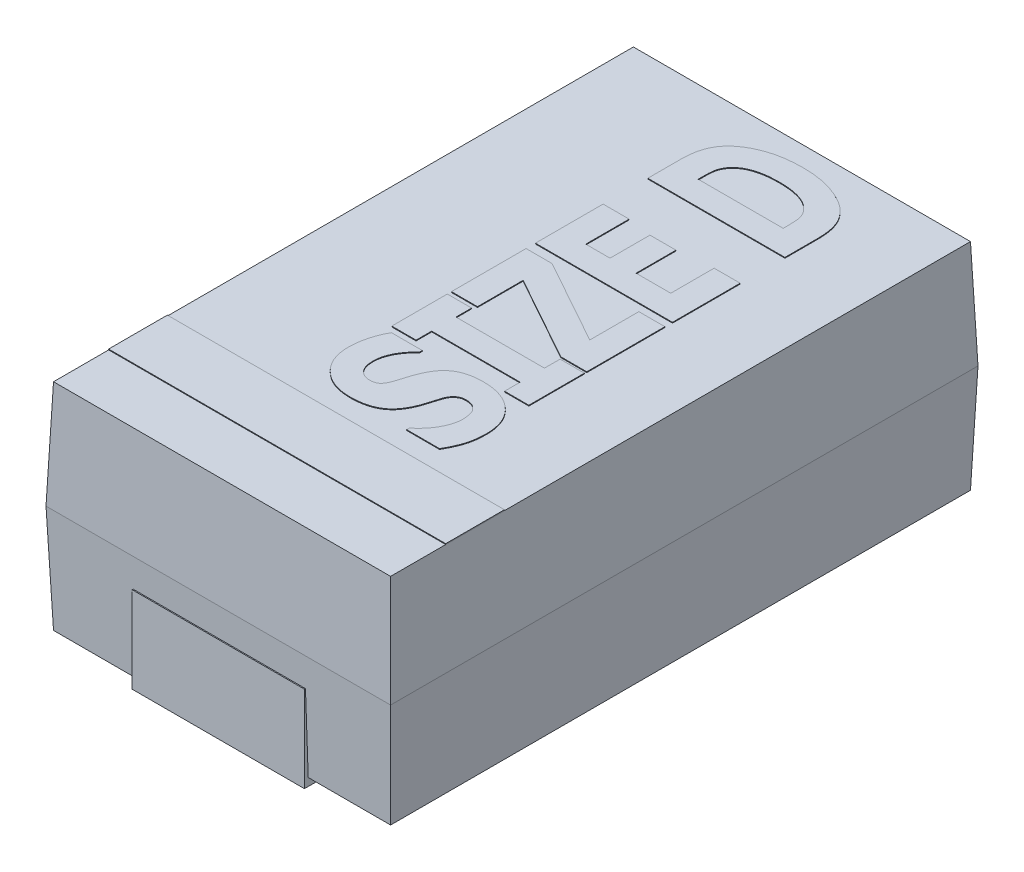
from build123d import *

# Parameters (mm, degrees)
SKETCH1_W                     = 4.4
SKETCH1_H                     = 7.5
BOSS_EXTRUDE1_DEPTH           = 1.375
BOSS_EXTRUDE1_TAPER           = 2
BOSS_EXTRUDE1_OTHER_WAY_DEPTH = 1.375
BOSS_EXTRUDE1_OTHER_WAY_TAPER = 2
BOSS_EXTRUDE2_DEPTH           = 0.1
BOSS_EXTRUDE2_DEPTH_BACK      = 1
SKETCH2_W                     = 2.2
SKETCH2_H                     = 1.35
SKETCH3_W                     = 4.303967884
SKETCH3_H                     = 0.75
EXTRUDE_THIN1_DEPTH           = 0.01
BOSS_EXTRUDE3_DEPTH           = 0.01


with BuildPart() as part:
    # Sketch1 → Boss-Extrude1 (new body)
    with BuildSketch(Plane(origin=(0, 0, 0), x_dir=(1, 0, 0), z_dir=(0, 1, 0))):
        Rectangle(SKETCH1_W, SKETCH1_H)
    extrude(amount=BOSS_EXTRUDE1_DEPTH, taper=BOSS_EXTRUDE1_TAPER)

    # Sketch1 → Boss-Extrude1 other way (add)
    with BuildSketch(Plane(origin=(0, 0, 0), x_dir=(1, 0, 0), z_dir=(0, 1, 0))):
        Rectangle(SKETCH1_W, SKETCH1_H)
    extrude(amount=-BOSS_EXTRUDE1_OTHER_WAY_DEPTH, taper=BOSS_EXTRUDE1_OTHER_WAY_TAPER)

    # Sketch2 → Boss-Extrude2 (add, two sides: drawn at the far end of the back side and taken through both)
    with BuildSketch(Plane.XZ.offset(1.375).offset(-BOSS_EXTRUDE2_DEPTH_BACK)):
        with Locations((0, 3.075)):
            Rectangle(SKETCH2_W, SKETCH2_H)
        with Locations((0, -3.075)):
            Rectangle(SKETCH2_W, SKETCH2_H)
    extrude(amount=BOSS_EXTRUDE2_DEPTH + BOSS_EXTRUDE2_DEPTH_BACK)

    # Sketch3 → Extrude-Thin1 (add)
    with BuildSketch(Plane(origin=(0, 1.375, 0), x_dir=(1, 0, 0), z_dir=(0, 1, 0))):
        with Locations((0, -2.623518775)):
            Rectangle(SKETCH3_W, SKETCH3_H)
    extrude(amount=EXTRUDE_THIN1_DEPTH)

    # Sketch4 → Boss-Extrude3 (add)
    # profile 1 of 5: a face of its own
    with BuildSketch(Plane(origin=(0, 1.375, 0), x_dir=(1, 0, 0), z_dir=(0, 1, 0))):
        with BuildLine():
            add(Edge.make_bspline(
                [(0.606493436, -0.96788767), (0.627855348, -0.968366119), (0.669656113, -0.969302344), (0.730823984, -0.976239091), (0.788809907, -0.988057313), (0.843852466, -1.004172825), (0.895652151, -1.025576177), (0.944728289, -1.050971871), (0.990251937, -1.081914297), (1.032841449, -1.116597553), (1.071146809, -1.155599613), (1.104705699, -1.19819034), (1.133156378, -1.244036569), (1.15664734, -1.293166777), (1.174161804, -1.345921935), (1.186860597, -1.40190815), (1.195161094, -1.46121267), (1.195906837, -1.501927579), (1.196287739, -1.522723508)],
                knots=[0, 0, 0, 0, 1.123231077, 2.197926755, 3.231931198, 4.23205902, 5.208893471, 6.175023653, 7.132504262, 8.098119942, 9.059150163, 10.001029427, 10.943846196, 11.890986852, 12.857973929, 13.860252586, 14.907082517, 16, 16, 16, 16], degree=3))
            add(Edge.make_bspline(
                [(1.196287739, -1.522723508), (1.195812717, -1.546621277), (1.194892682, -1.59290706), (1.188098086, -1.66010049), (1.176011938, -1.72250347), (1.159252817, -1.780556867), (1.138237159, -1.834866482), (1.115427196, -1.887379779), (1.090014195, -1.93818957), (1.070832731, -1.970711646), (1.061299607, -1.986875011)],
                knots=[0, 0, 0, 0, 1.170088317, 2.26625562, 3.302187664, 4.278401643, 5.220628038, 6.151609465, 7.08135594, 8, 8, 8, 8], degree=3))
            Line((1.061299607, -1.986875011), (0.642490271, -1.986875011))
            Line((0.642490271, -1.986875011), (0.642490271, -1.952954916))
            add(Edge.make_bspline(
                [(0.642490271, -1.952954916), (0.661306582, -1.936832417), (0.698242914, -1.905184025), (0.746577893, -1.852166473), (0.788713744, -1.796837434), (0.823297568, -1.738991535), (0.85115917, -1.680502263), (0.870930943, -1.62230799), (0.884008057, -1.565301286), (0.885454206, -1.527404462), (0.886161157, -1.508878571)],
                knots=[0, 0, 0, 0, 1.137748405, 2.233394795, 3.289549256, 4.328854387, 5.325001514, 6.260582723, 7.149684573, 8, 8, 8, 8], degree=3))
            add(Edge.make_bspline(
                [(0.886161157, -1.508878571), (0.885639877, -1.497902066), (0.884460308, -1.47306407), (0.879517882, -1.44112613), (0.874156377, -1.413350639), (0.868220554, -1.393493956), (0.861569254, -1.375368903), (0.855285345, -1.364813173), (0.852241062, -1.359699378)],
                knots=[0, 0, 0, 0, 1.279356194, 2.894969178, 3.759536177, 4.571858236, 5.308127055, 6, 6, 6, 6], degree=3))
            add(Edge.make_bspline(
                [(0.852241062, -1.359699378), (0.84380226, -1.348455921), (0.827011983, -1.326085357), (0.799096884, -1.303778096), (0.772745683, -1.290084886), (0.748320381, -1.283086154), (0.719844643, -1.278574343), (0.699390478, -1.278208564), (0.688524686, -1.278014252)],
                knots=[0, 0, 0, 0, 1.313748587, 2.613902296, 3.305346579, 4.085142053, 4.982776842, 6, 6, 6, 6], degree=3))
            add(Edge.make_bspline(
                [(0.688524686, -1.278014252), (0.67902821, -1.278384518), (0.6606231, -1.279102131), (0.633972213, -1.285535977), (0.609543518, -1.296418994), (0.587051708, -1.311416226), (0.567415613, -1.330910422), (0.549241212, -1.35357463), (0.534681421, -1.38091201), (0.526805826, -1.400692609), (0.522731569, -1.410925644)],
                knots=[0, 0, 0, 0, 0.997552441, 1.93335531, 2.862211005, 3.797699212, 4.758724122, 5.761134443, 6.841774632, 8, 8, 8, 8], degree=3))
            add(Edge.make_bspline(
                [(0.522731569, -1.410925644), (0.514942542, -1.434410807), (0.499014678, -1.48243587), (0.478266157, -1.555922054), (0.456415988, -1.629608591), (0.435455688, -1.676023381), (0.425124765, -1.698900328)],
                knots=[0, 0, 0, 0, 0.975309188, 1.994420259, 3.011488788, 4, 4, 4, 4], degree=3))
            add(Edge.make_bspline(
                [(0.425124765, -1.698900328), (0.4189248, -1.711320469), (0.406785652, -1.735638338), (0.38641346, -1.770227869), (0.3636281, -1.801499889), (0.340296623, -1.831048354), (0.314527002, -1.857183308), (0.287489455, -1.881004049), (0.258512235, -1.901779232), (0.228141601, -1.920222868), (0.195761113, -1.935761925), (0.161912597, -1.949806496), (0.125821165, -1.96105705), (0.087982377, -1.970287818), (0.048420955, -1.978141996), (0.006878108, -1.983079526), (-0.036551629, -1.986326192), (-0.066133413, -1.986689375), (-0.081253795, -1.986875011)],
                knots=[0, 0, 0, 0, 1.073445682, 2.101740216, 3.099543666, 4.063832661, 5.010289146, 5.933583054, 6.847386585, 7.763973722, 8.677777253, 9.622212832, 10.59574541, 11.597689141, 12.633619916, 13.712650431, 14.830848108, 16, 16, 16, 16], degree=3))
            add(Edge.make_bspline(
                [(-0.081253795, -1.986875011), (-0.101463672, -1.986396346), (-0.141081839, -1.985458002), (-0.199021417, -1.978500273), (-0.254095156, -1.966786321), (-0.306204719, -1.95004361), (-0.355701785, -1.928946911), (-0.402331714, -1.902818394), (-0.446026038, -1.87191743), (-0.486466844, -1.836627635), (-0.523025325, -1.797696675), (-0.555059936, -1.755778085), (-0.581821016, -1.71095973), (-0.604281043, -1.663803385), (-0.621042576, -1.61350466), (-0.633644848, -1.56085209), (-0.640976591, -1.505393043), (-0.641865977, -1.467595926), (-0.642319856, -1.448306973)],
                knots=[0, 0, 0, 0, 1.110899699, 2.17773761, 3.202861202, 4.201826735, 5.182111527, 6.156137979, 7.134615264, 8.119159157, 9.101903375, 10.066048987, 11.013525875, 11.96690795, 12.931720993, 13.922517702, 14.939801223, 16, 16, 16, 16], degree=3))
            add(Edge.make_bspline(
                [(-0.642319856, -1.448306973), (-0.641924026, -1.428560954), (-0.641130425, -1.388972032), (-0.634579, -1.32990217), (-0.624645268, -1.271133063), (-0.610547319, -1.213438662), (-0.592818142, -1.15805368), (-0.573677492, -1.105522567), (-0.55200397, -1.057064039), (-0.535447246, -1.026859538), (-0.527406881, -1.012191467)],
                knots=[0, 0, 0, 0, 1.039519936, 2.084140277, 3.125876998, 4.176486779, 5.208308838, 6.186738043, 7.119434044, 8, 8, 8, 8], degree=3))
            Line((-0.527406881, -1.012191467), (-0.132826185, -1.012191467))
            Line((-0.132826185, -1.012191467), (-0.132826185, -1.045765439))
            add(Edge.make_bspline(
                [(-0.132826185, -1.045765439), (-0.146735335, -1.058515278), (-0.174652549, -1.084105626), (-0.211453744, -1.128027838), (-0.245746998, -1.175216426), (-0.275787408, -1.226131698), (-0.300839425, -1.279417314), (-0.318996531, -1.334084824), (-0.330264884, -1.389579142), (-0.331551383, -1.426911349), (-0.332193273, -1.445537986)],
                knots=[0, 0, 0, 0, 0.984070871, 1.97513988, 2.984813114, 4.027106165, 5.056510584, 6.052673032, 7.028395148, 8, 8, 8, 8], degree=3))
            add(Edge.make_bspline(
                [(-0.332193273, -1.445537986), (-0.331762123, -1.458596281), (-0.330895, -1.484858902), (-0.324790459, -1.524202378), (-0.31269949, -1.563242602), (-0.298769447, -1.586872965), (-0.291696833, -1.59887066)],
                knots=[0, 0, 0, 0, 0.97418877, 1.959271968, 2.963873987, 4, 4, 4, 4], degree=3))
            add(Edge.make_bspline(
                [(-0.291696833, -1.59887066), (-0.288123307, -1.604038373), (-0.280785181, -1.614650112), (-0.267229252, -1.629158623), (-0.25099397, -1.642427518), (-0.232508811, -1.654421249), (-0.21202133, -1.664494837), (-0.189682555, -1.671312335), (-0.166257445, -1.676092255), (-0.150041859, -1.676527759), (-0.141825393, -1.676748429)],
                knots=[0, 0, 0, 0, 0.855403996, 1.756545736, 2.694648507, 3.706409739, 4.754179369, 5.793420774, 6.88192253, 8, 8, 8, 8], degree=3))
            add(Edge.make_bspline(
                [(-0.141825393, -1.676748429), (-0.130705959, -1.676326743), (-0.109723866, -1.675531032), (-0.080259335, -1.668468074), (-0.054794242, -1.657095419), (-0.032643935, -1.640233705), (-0.014016146, -1.616256694), (0.003488975, -1.585291171), (0.020369688, -1.546292654), (0.029672885, -1.517055088), (0.03469755, -1.501263856)],
                knots=[0, 0, 0, 0, 0.977411615, 1.844351051, 2.648603566, 3.416320099, 4.267959932, 5.300768973, 6.542143255, 8, 8, 8, 8], degree=3))
            add(Edge.make_bspline(
                [(0.03469755, -1.501263856), (0.04128472, -1.479461064), (0.054225895, -1.436627228), (0.073532455, -1.372047659), (0.096505344, -1.306335422), (0.116139865, -1.262984699), (0.126420255, -1.240286799)],
                knots=[0, 0, 0, 0, 0.986893501, 1.938854128, 2.920809672, 4, 4, 4, 4], degree=3))
            add(Edge.make_bspline(
                [(0.126420255, -1.240286799), (0.132023518, -1.229005225), (0.143086342, -1.2067314), (0.162326045, -1.175323236), (0.182503091, -1.145863043), (0.204565395, -1.118944424), (0.228148744, -1.094397351), (0.253026562, -1.071823571), (0.279462438, -1.051549825), (0.307721191, -1.033914224), (0.337725567, -1.018101744), (0.369887285, -1.004801211), (0.404083788, -0.993227261), (0.440437059, -0.983998536), (0.47893435, -0.976744745), (0.519618202, -0.971604006), (0.562370443, -0.968461386), (0.591604666, -0.968081263), (0.606493436, -0.96788767)],
                knots=[0, 0, 0, 0, 1.027654046, 2.028953039, 3.003320805, 3.940198746, 4.865983912, 5.77942601, 6.679715928, 7.581088694, 8.495113097, 9.444776638, 10.41855265, 11.439497146, 12.50331839, 13.614116899, 14.784887726, 16, 16, 16, 16], degree=3))
        make_face()
    # profile 2 of 5: a face of its own
    with BuildSketch(Plane(origin=(0, 1.375, 0), x_dir=(1, 0, 0), z_dir=(0, 1, 0))):
        Polygon((1.151983942, -0.228014252), (1.151983942, -0.936875011), (0.84185736, -0.936875011), (0.84185736, -0.737507923), (-0.287889476, -0.737507923), (-0.287889476, -0.936875011), (-0.598016058, -0.936875011), (-0.598016058, -0.228014252), (-0.287889476, -0.228014252), (-0.287889476, -0.42738134), (0.84185736, -0.42738134), (0.84185736, -0.228014252), align=None)
    # profile 3 of 5: a face of its own
    with BuildSketch(Plane(origin=(0, 1.375, 0), x_dir=(1, 0, 0), z_dir=(0, 1, 0))):
        Polygon((1.151983942, 0.799833849), (1.151983942, -0.197001594), (0.819705461, -0.197001594), (-0.265737577, 0.407676017), (-0.265737577, -0.174849695), (-0.598016058, -0.174849695), (-0.598016058, 0.777681951), (-0.265737577, 0.777681951), (0.819705461, 0.173350463), (0.819705461, 0.799833849), align=None)
    # profile 4 of 5: a face of its own
    with BuildSketch(Plane(origin=(0, 1.375, 0), x_dir=(1, 0, 0), z_dir=(0, 1, 0))):
        Polygon((1.151983942, 1.761226254), (1.151983942, 0.897302204), (-0.598016058, 0.897302204), (-0.598016058, 1.761226254), (-0.265737577, 1.761226254), (-0.265737577, 1.207428786), (0.044389005, 1.207428786), (0.044389005, 1.716922457), (0.376667486, 1.716922457), (0.376667486, 1.207428786), (0.819705461, 1.207428786), (0.819705461, 1.761226254), align=None)
    # profile 5 of 5: a face of its own
    with BuildSketch(Plane(origin=(0, 1.375, 0), x_dir=(1, 0, 0), z_dir=(0, 1, 0))):
        with BuildLine():
            add(Edge.make_bspline(
                [(0.278714559, 3.440340179), (0.298794878, 3.440170187), (0.338524892, 3.439833849), (0.397304738, 3.4362705), (0.454484369, 3.430489157), (0.509992314, 3.42202893), (0.563988386, 3.411834119), (0.616416704, 3.398930001), (0.667290022, 3.383807561), (0.71628734, 3.366082011), (0.763030132, 3.346846868), (0.807303361, 3.326361794), (0.848651235, 3.304640859), (0.887471139, 3.281867112), (0.922855708, 3.257117121), (0.956041826, 3.232042823), (0.986033958, 3.205192139), (1.004197558, 3.186062976), (1.013188451, 3.176594134)],
                knots=[0, 0, 0, 0, 1.202299543, 2.37881569, 3.524792316, 4.642557387, 5.740069071, 6.814150526, 7.874253958, 8.91664992, 9.932775139, 10.900245547, 11.836602954, 12.728793994, 13.593077179, 14.420800829, 15.218304153, 16, 16, 16, 16], degree=3))
            add(Edge.make_bspline(
                [(1.013188451, 3.176594134), (1.025559597, 3.162223716), (1.049867265, 3.13398774), (1.079513109, 3.087282503), (1.104244631, 3.039152279), (1.12212429, 2.987989494), (1.1357126, 2.93386727), (1.145348403, 2.87553114), (1.150699572, 2.812342069), (1.151545847, 2.768640029), (1.151983942, 2.746016603)],
                knots=[0, 0, 0, 0, 0.979866063, 1.925307591, 2.854324583, 3.773857627, 4.722159233, 5.738844466, 6.829457763, 8, 8, 8, 8], degree=3))
            Line((1.151983942, 2.746016603), (1.151983942, 2.332745242))
            Line((1.151983942, 2.332745242), (-0.598016058, 2.332745242))
            Line((-0.598016058, 2.332745242), (-0.598016058, 2.757784799))
            add(Edge.make_bspline(
                [(-0.598016058, 2.757784799), (-0.597714195, 2.780880957), (-0.597130109, 2.825570643), (-0.589928508, 2.889995153), (-0.579176806, 2.949596747), (-0.56350389, 3.004269243), (-0.543745508, 3.054635417), (-0.519739401, 3.100444937), (-0.492958399, 3.142879104), (-0.471325002, 3.167505962), (-0.460605061, 3.179709245)],
                knots=[0, 0, 0, 0, 1.219258587, 2.359192532, 3.419277855, 4.414487454, 5.358201337, 6.271217898, 7.143341151, 8, 8, 8, 8], degree=3))
            add(Edge.make_bspline(
                [(-0.460605061, 3.179709245), (-0.451153415, 3.189640759), (-0.43206871, 3.209694409), (-0.400808689, 3.237801944), (-0.366859109, 3.263918804), (-0.330766972, 3.288672403), (-0.292140307, 3.311429565), (-0.251337731, 3.332996175), (-0.20788823, 3.352589214), (-0.162377643, 3.371010692), (-0.114421609, 3.387297167), (-0.064362893, 3.401355575), (-0.012173141, 3.413546644), (0.041986316, 3.42353442), (0.098234643, 3.431208603), (0.156585537, 3.436105853), (0.216940266, 3.439886729), (0.257940825, 3.440187691), (0.278714559, 3.440340179)],
                knots=[0, 0, 0, 0, 0.815982718, 1.647627183, 2.499420194, 3.36432123, 4.251303357, 5.166838833, 6.110438719, 7.087419556, 8.088723728, 9.123690057, 10.18162513, 11.278206396, 12.401101364, 13.559583676, 14.763515377, 16, 16, 16, 16], degree=3))
        make_face()
        with BuildLine():
            add(Edge.make_bspline(
                [(0.275945572, 3.130213596), (0.248354495, 3.129658509), (0.19525339, 3.128590201), (0.118590346, 3.12111976), (0.04816352, 3.10806156), (-0.016226846, 3.089985221), (-0.07432007, 3.066187626), (-0.125808737, 3.036219202), (-0.171129331, 3.000144348), (-0.195468372, 2.970982031), (-0.207588843, 2.956459641)],
                knots=[0, 0, 0, 0, 1.244029734, 2.394228946, 3.468625209, 4.469754134, 5.404955682, 6.2909402, 7.148914245, 8, 8, 8, 8], degree=3))
            add(Edge.make_bspline(
                [(-0.207588843, 2.956459641), (-0.212947809, 2.948952163), (-0.223500258, 2.934169035), (-0.236154602, 2.910604465), (-0.246284145, 2.886840548), (-0.25442712, 2.862027158), (-0.259403988, 2.833846053), (-0.263097465, 2.800789391), (-0.265513662, 2.761626258), (-0.265659399, 2.733444498), (-0.265737577, 2.718326729)],
                knots=[0, 0, 0, 0, 0.883959638, 1.740623016, 2.558679227, 3.360100395, 4.239058806, 5.297346294, 6.550193753, 8, 8, 8, 8], degree=3))
            Line((-0.265737577, 2.718326729), (-0.265737577, 2.642871824))
            Line((-0.265737577, 2.642871824), (0.819705461, 2.642871824))
            Line((0.819705461, 2.642871824), (0.819705461, 2.718326729))
            add(Edge.make_bspline(
                [(0.819705461, 2.718326729), (0.819445915, 2.734940128), (0.818964364, 2.765764017), (0.817053614, 2.808585299), (0.81214525, 2.844174586), (0.805997265, 2.87406965), (0.796947801, 2.900084134), (0.784875468, 2.924564976), (0.770041601, 2.948793269), (0.758240281, 2.964176456), (0.752211394, 2.972035194)],
                knots=[0, 0, 0, 0, 1.482715842, 2.750976389, 3.821049852, 4.685289439, 5.46989593, 6.271009598, 7.11671854, 8, 8, 8, 8], degree=3))
            add(Edge.make_bspline(
                [(0.752211394, 2.972035194), (0.740053289, 2.985298948), (0.715546914, 3.012033912), (0.670529008, 3.044222125), (0.620635582, 3.07204753), (0.564267478, 3.093673168), (0.501658851, 3.110070802), (0.432563905, 3.122178701), (0.356492824, 3.128837675), (0.303532734, 3.129742348), (0.275945572, 3.130213596)],
                knots=[0, 0, 0, 0, 0.831800493, 1.676611046, 2.550120947, 3.474513637, 4.465403317, 5.545747059, 6.721567975, 8, 8, 8, 8], degree=3))
        make_face(mode=Mode.SUBTRACT)
    extrude(amount=BOSS_EXTRUDE3_DEPTH)


solid = part.part
